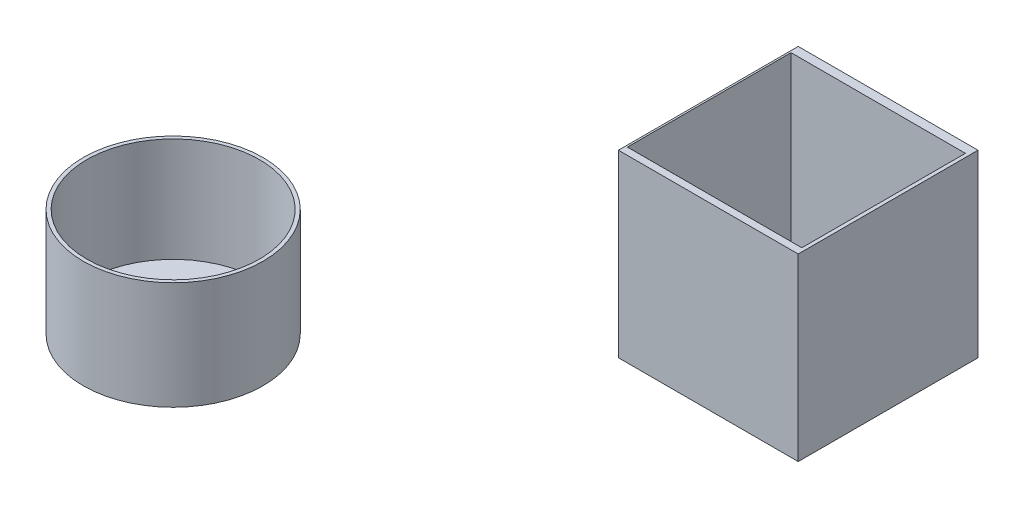
from build123d import *

# Parameters (mm, degrees)
SKETCH1_R                 = 50
BOSS_EXTRUDE1_DEPTH       = 60
SHELL1_T                  = -2
SKETCH2_W                 = 100
SKETCH2_H                 = 100
BOSS_EXTRUDE2_DEPTH       = 100
SHELL2_T                  = -2
SHELL2_THICKNESS_2_FACE_W = 96
SHELL2_THICKNESS_2_FACE_H = 98
SHELL2_THICKNESS_2_DEPTH  = 3
SHELL2_THICKNESS_3_FACE_W = 93
SHELL2_THICKNESS_3_FACE_H = 98
SHELL2_THICKNESS_3_DEPTH  = 1
SHELL2_THICKNESS_4_FACE_W = 97
SHELL2_THICKNESS_4_FACE_H = 98
SHELL2_THICKNESS_4_DEPTH  = 2


with BuildPart() as part:
    # Sketch1 → Boss-Extrude1 (new body)
    with BuildSketch(Plane(origin=(0, 0, 0), x_dir=(1, 0, 0), z_dir=(0, 1, 0))):
        with Locations(Location((0, 0, 0), (0, 0, 270))):
            Circle(SKETCH1_R)
    extrude(amount=BOSS_EXTRUDE1_DEPTH)

    # Shell1
    shell1_openings = [part.faces().sort_by_distance(p)[0] for p in [
        (0, 60, 0),
    ]]
    offset(amount=SHELL1_T, openings=shell1_openings, kind=Kind.INTERSECTION)


with BuildPart() as body_2:
    # Sketch2 → Boss-Extrude2 (new body)
    with BuildSketch(Plane(origin=(0, 0, 0), x_dir=(1, 0, 0), z_dir=(0, 1, 0))):
        with Locations((185.338998585, 162.342028324)):
            Rectangle(SKETCH2_W, SKETCH2_H)
    extrude(amount=BOSS_EXTRUDE2_DEPTH)

    # Shell2
    shell2_openings = [body_2.faces().sort_by_distance(p)[0] for p in [
        (185.338998585, 100, -162.342028324),
    ]]
    offset(amount=SHELL2_T, openings=shell2_openings, kind=Kind.INTERSECTION)

    # Shell2 thickness 2 face (on inner face of the shell) → Shell2 thickness 2 (add)
    with BuildSketch(Plane(origin=(185.338998585, 51, -210.342028324), x_dir=(-1, 0, 0), z_dir=(0, 0, -1))):
        Rectangle(SHELL2_THICKNESS_2_FACE_W, SHELL2_THICKNESS_2_FACE_H)
    extrude(amount=-SHELL2_THICKNESS_2_DEPTH)

    # Shell2 thickness 3 face (on inner face of the shell) → Shell2 thickness 3 (cut)
    with BuildSketch(Plane(origin=(137.338998585, 51, -160.842028324), x_dir=(0, 0, -1), z_dir=(-1, 0, 0))):
        Rectangle(SHELL2_THICKNESS_3_FACE_W, SHELL2_THICKNESS_3_FACE_H)
    extrude(amount=SHELL2_THICKNESS_3_DEPTH, mode=Mode.SUBTRACT)

    # Shell2 thickness 4 face (on inner face of the shell) → Shell2 thickness 4 (add)
    with BuildSketch(Plane(origin=(184.838998585, 51, -114.342028324), x_dir=(1, 0, 0), z_dir=(0, 0, 1))):
        Rectangle(SHELL2_THICKNESS_4_FACE_W, SHELL2_THICKNESS_4_FACE_H)
    extrude(amount=-SHELL2_THICKNESS_4_DEPTH)


solid = Compound([part.part, body_2.part])
